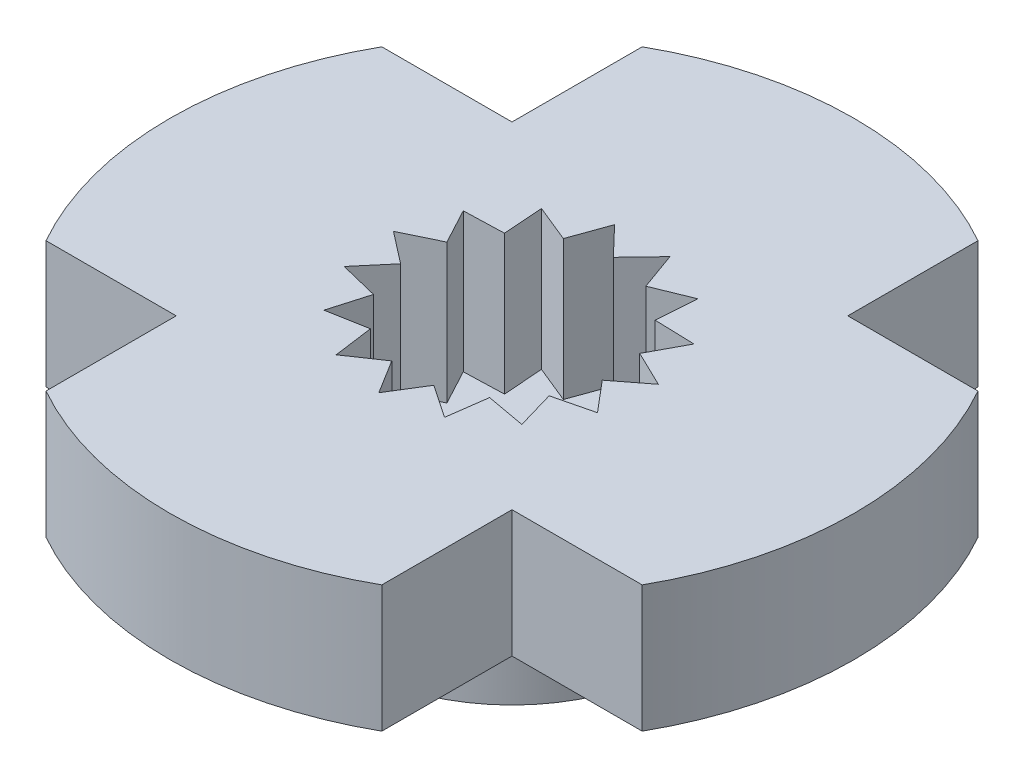
from build123d import *

# Parameters (mm, degrees)
EXTRUDE_1_DEPTH     = 2
SKETCH_2_R          = 2.575
SKETCH_2_R_2        = 0.85
EXTRUDE_2_DEPTH     = 1.5
SKETCH_3_R          = 1.55
CUT_EXTRUDE_1_DEPTH = 0.3
CUT_EXTRUDE_2_DEPTH = 2.2


with BuildPart() as part:
    # ｽｹｯﾁ1 → ﾎﾞｽ - 押し出し1 (new body)
    with BuildSketch(Plane(origin=(0, 0, 0), x_dir=(1, 0, 0), z_dir=(0, 1, 0))):
        with BuildLine():
            Line((2.65, 4.705050478), (2.65, 2.65))
            Line((2.65, 2.65), (4.705050478, 2.65))
            ThreePointArc((4.705050478, 2.65), (5.4, 0), (4.705050478, -2.65))
            Line((4.705050478, -2.65), (2.65, -2.65))
            Line((2.65, -2.65), (2.65, -4.705050478))
            ThreePointArc((2.65, -4.705050478), (0, -5.4), (-2.65, -4.705050478))
            Line((-2.65, -4.705050478), (-2.65, -2.65))
            Line((-2.65, -2.65), (-4.705050478, -2.65))
            ThreePointArc((-4.705050478, -2.65), (-5.4, 0), (-4.705050478, 2.65))
            Line((-4.705050478, 2.65), (-2.65, 2.65))
            Line((-2.65, 2.65), (-2.65, 4.705050478))
            ThreePointArc((-2.65, 4.705050478), (0, 5.4), (2.65, 4.705050478))
        make_face()
    extrude(amount=EXTRUDE_1_DEPTH)

    # ｽｹｯﾁ2 → ﾎﾞｽ - 押し出し2 (add)
    with BuildSketch(Plane.XZ):
        with Locations(Location((0, 0, 0), (0, 0, 90))):
            Circle(SKETCH_2_R)
        with Locations(Location((0, 0, 0), (0, 0, 270))):
            Circle(SKETCH_2_R_2, mode=Mode.SUBTRACT)
    extrude(amount=EXTRUDE_2_DEPTH)

    # ｽｹｯﾁ3 → ｶｯﾄ - 押し出し1 (cut)
    with BuildSketch(Plane.XZ.offset(1.5)):
        with Locations(Location((0, 0, 0), (0, 0, 270))):
            Circle(SKETCH_3_R)
    extrude(amount=-CUT_EXTRUDE_1_DEPTH, mode=Mode.SUBTRACT)

    # ｽｹｯﾁ4 → ｶｯﾄ - 押し出し2 (cut)
    with BuildSketch(Plane(origin=(0, 2, 0), x_dir=(1, 0, 0), z_dir=(0, 1, 0))):
        Polygon((0, 1.6), (0.437016815, 2.056002469), (0.650778629, 1.461672732), (1.235486269, 1.700500964), (1.189031721, 1.07060897), (1.820328922, 1.050967393), (1.521690426, 0.494427191), (2.090420168, 0.219712013), (1.591235033, -0.167245541), (1.999058776, -0.64953357), (1.385640646, -0.8), (1.56204196, -1.406468898), (0.940456404, -1.294427191), (0.854933899, -1.920212977), (0.332658705, -1.565036161), (0, -2.101934787), (-0.332658705, -1.565036161), (-0.854933899, -1.920212977), (-0.940456404, -1.294427191), (-1.56204196, -1.406468898), (-1.385640646, -0.8), (-1.999058776, -0.64953357), (-1.591235033, -0.167245541), (-2.090420168, 0.219712013), (-1.521690426, 0.494427191), (-1.820328922, 1.050967393), (-1.189031721, 1.07060897), (-1.235486269, 1.700500964), (-0.650778629, 1.461672732), (-0.437016815, 2.056002469), align=None)
    extrude(amount=-CUT_EXTRUDE_2_DEPTH, mode=Mode.SUBTRACT)


solid = part.part
